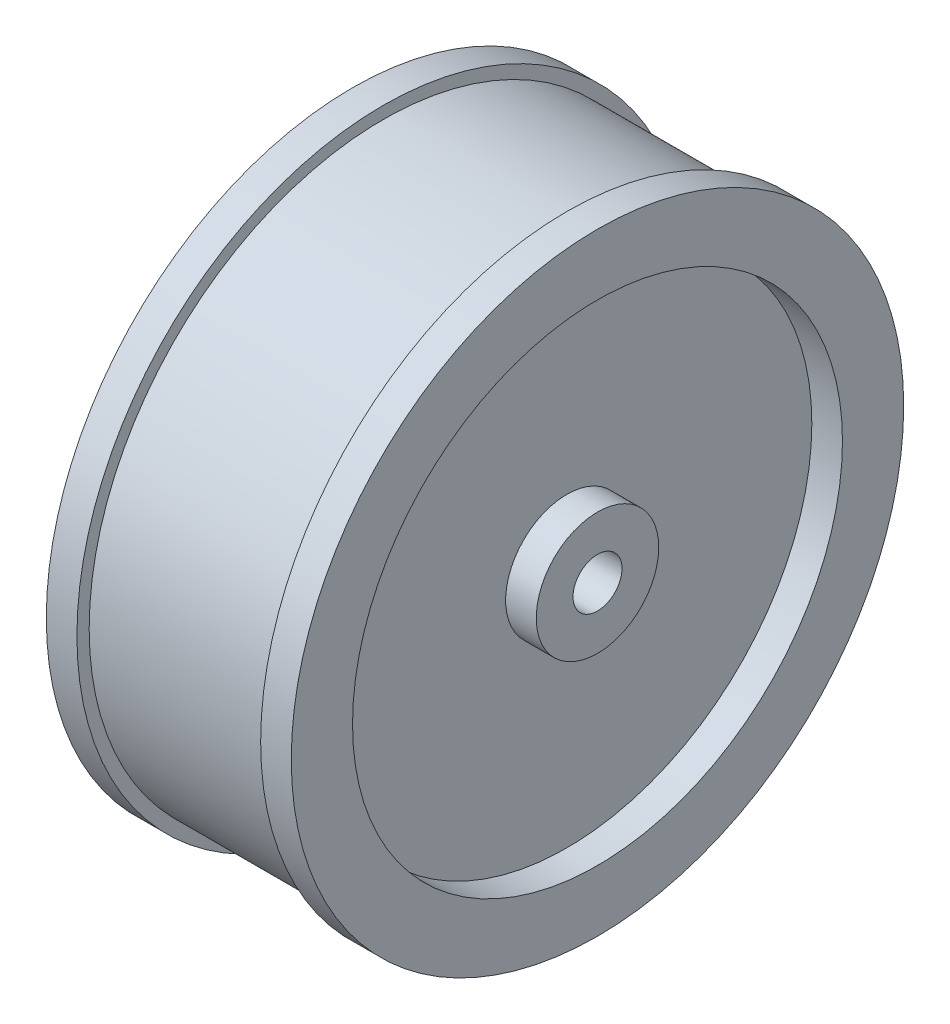
from build123d import *


with BuildPart() as part:
    # Sketch1 → Revolve1 (revolve)
    with BuildSketch(Plane.XY, mode=Mode.PRIVATE) as revolve1_sk:
        Polygon((0, 4), (-40, 4), (-40, 10), (-35, 10), (-35, 40), (-40, 40), (-40, 48), (-40, 50), (-35, 50), (-35, 48), (-5, 48), (-5, 50), (0, 50), (0, 40), (-5, 40), (-5, 10), (0, 10), align=None)
    revolve(revolve1_sk.sketch.rotate(Axis((0, 0, 0), (-1, 0, 0)), 90), axis=Axis((0, 0, 0), (-1, 0, 0)))


solid = part.part
